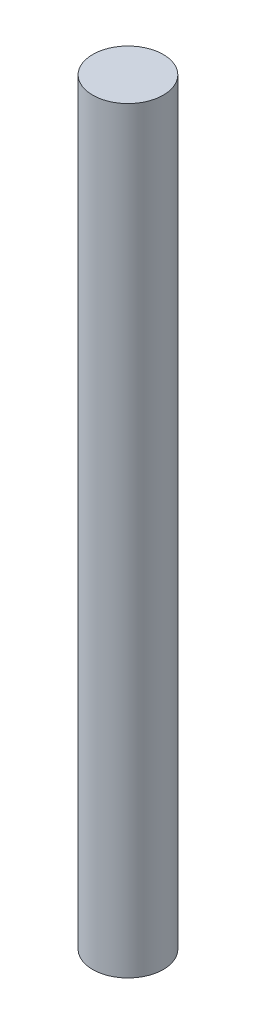
from build123d import *

# Parameters (mm, degrees)
SKETCH1_R           = 1.5
BOSS_EXTRUDE1_DEPTH = 32.2


with BuildPart() as part:
    # Sketch1 → Boss-Extrude1 (new body)
    with BuildSketch(Plane(origin=(0, 0, 0), x_dir=(1, 0, 0), z_dir=(0, 1, 0))):
        with Locations(Location((0, 0, 0), (0, 0, 270))):
            Circle(SKETCH1_R)
    extrude(amount=BOSS_EXTRUDE1_DEPTH)


solid = part.part
